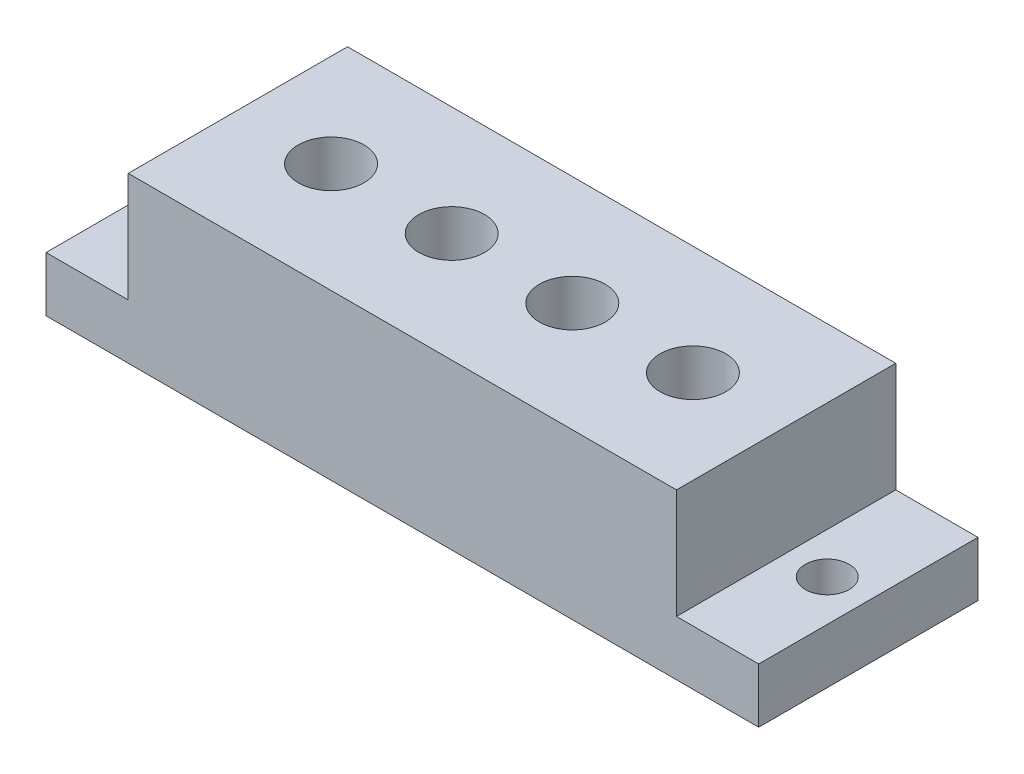
from build123d import *

# Parameters (mm, degrees)
SKETCH_1_W          = 130
SKETCH_1_H          = 40
EXTRUDE_1_DEPTH     = 10
SKETCH_2_W          = 100
SKETCH_2_H          = 40
EXTRUDE_2_DEPTH     = 20
SKETCH_3_R          = 6
CUT_EXTRUDE_1_DEPTH = 20
SKETCH_4_R          = 4
CUT_EXTRUDE_2_DEPTH = 75.330343737


with BuildPart() as part:
    # 草图1 → 凸台-拉伸1 (new body)
    with BuildSketch(Plane(origin=(0, 0, 0), x_dir=(1, 0, 0), z_dir=(0, 1, 0))):
        Rectangle(SKETCH_1_W, SKETCH_1_H)
    extrude(amount=EXTRUDE_1_DEPTH)

    # 草图2 → 凸台-拉伸2 (add)
    with BuildSketch(Plane(origin=(0, 10, 0), x_dir=(1, 0, 0), z_dir=(0, 1, 0))):
        Rectangle(SKETCH_2_W, SKETCH_2_H)
    extrude(amount=EXTRUDE_2_DEPTH)

    # 草图3 → 切除-拉伸1 (cut)
    with BuildSketch(Plane(origin=(0, 30, 0), x_dir=(1, 0, 0), z_dir=(0, 1, 0))):
        with Locations(Location((-33, 0, 0), (0, 0, 270))):
            Circle(SKETCH_3_R)
        with Locations(Location((-11, 0, 0), (0, 0, 270))):
            Circle(SKETCH_3_R)
        with Locations(Location((11, 0, 0), (0, 0, 270))):
            Circle(SKETCH_3_R)
        with Locations(Location((33, 0, 0), (0, 0, 270))):
            Circle(SKETCH_3_R)
    extrude(amount=-CUT_EXTRUDE_1_DEPTH, mode=Mode.SUBTRACT)

    # 草图4 → 切除-拉伸2 (cut, through all)
    with BuildSketch(Plane(origin=(0, 30, 0), x_dir=(1, 0, 0), z_dir=(0, 1, 0))):
        with Locations(Location((-57.5, 0, 0), (0, 0, 270))):
            Circle(SKETCH_4_R)
        with Locations(Location((57.5, 0, 0), (0, 0, 270))):
            Circle(SKETCH_4_R)
    extrude(amount=-CUT_EXTRUDE_2_DEPTH, mode=Mode.SUBTRACT)


solid = part.part
